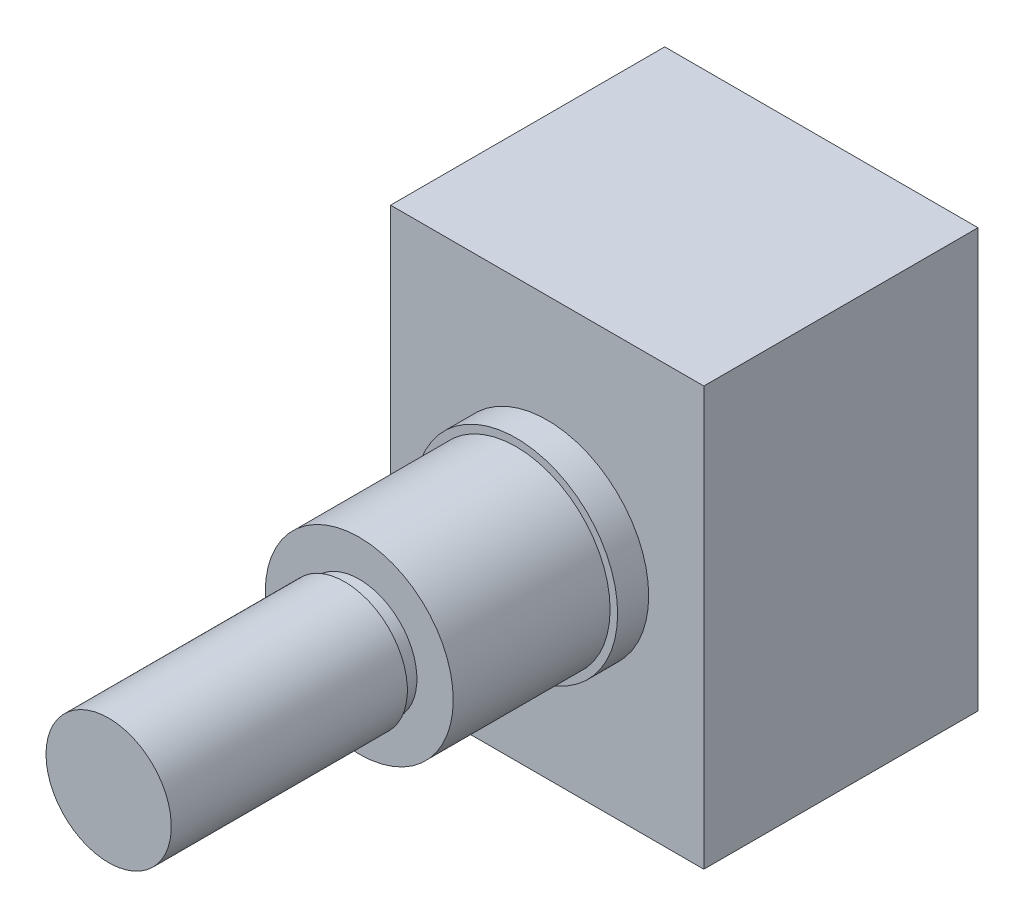
from build123d import *

# Parameters (mm, degrees)
SKETCH1_W           = 15.875
SKETCH1_H           = 21.209
BOSS_EXTRUDE1_DEPTH = 13.8938


with BuildPart() as part:
    # Sketch1 → Boss-Extrude1 (new body)
    with BuildSketch(Plane.XY.offset(13.8938)):
        Rectangle(SKETCH1_W, SKETCH1_H)
    extrude(amount=-BOSS_EXTRUDE1_DEPTH)

    # Sketch2 → Revolve1 (revolve)
    with BuildSketch(Plane.XZ, mode=Mode.PRIVATE) as revolve1_sk:
        Polygon((3.175, 36.1188), (0, 36.1188), (0, 13.8938), (5.1435, 13.8938), (5.1435, 15.4686), (4.7625, 15.4686), (4.7625, 23.4188), (2.921, 23.4188), (2.921, 24.1554), (3.175, 24.1554), align=None)
    revolve(revolve1_sk.sketch.rotate(Axis((0, 0, 36.1188), (0, 0, -1)), 180), axis=Axis((0, 0, 36.1188), (0, 0, -1)))


solid = part.part
